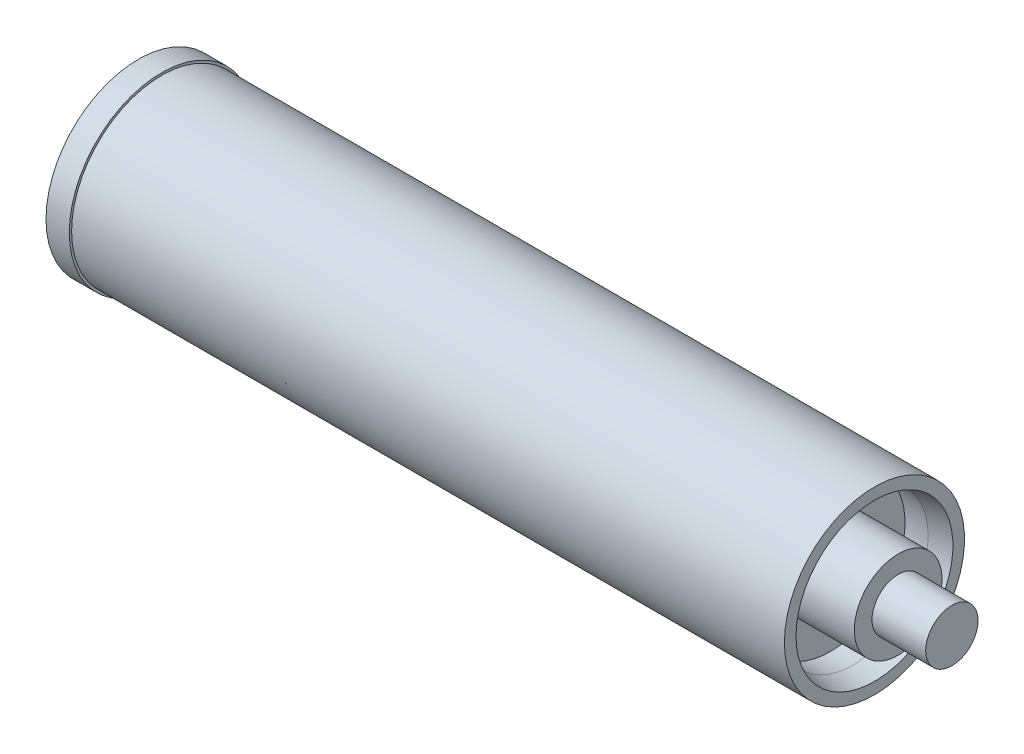
from build123d import *


with BuildPart() as part:
    # Esquisse2 → Révolution7 (revolve)
    with BuildSketch(Plane.XY, mode=Mode.PRIVATE) as r_volution7_sk:
        Polygon((0, 26), (12.7, 26), (36.56741584, 26), (36.56741584, 35.689138439), (25.4, 35.689138439), (12.7, 38.2095), (12.7, 50.419), (25.4, 50.419), (25.4, 49.149), (414.3502, 49.149), (414.3502, 42.820187711), (403.02734835, 40.573126289), (390.454818395, 40.573126289), (390.454818395, 23.9395), (427.3042, 23.9395), (427.3042, 14.2875), (456.5904, 14.2875), (456.5904, 0), (0, 0), align=None)
    revolve(r_volution7_sk.sketch.rotate(Axis((0, 0, 0), (1, 0, 0)), 90), axis=Axis((0, 0, 0), (1, 0, 0)))

    # Esquisse3 → Enlèvement de matière-Révolution1 (revolve, cut)
    with BuildSketch(Plane.XY, mode=Mode.PRIVATE) as enl_vement_de_mati_re_r_volution1_sk:
        Polygon((0, 20), (0, 0), (390.090795287, 0), (390.454818395, 12.957757221), (381.061065959, 12.957757221), (381.061065959, 44.271024873), (65.871878934, 44.271024873), (34.08300614, 14.327580407), (19.08300614, 14.327580407), align=None)
    revolve(enl_vement_de_mati_re_r_volution1_sk.sketch.rotate(Axis((0, 0, 0), (1, 0, 0)), 90), axis=Axis((0, 0, 0), (1, 0, 0)), mode=Mode.SUBTRACT)


solid = part.part
